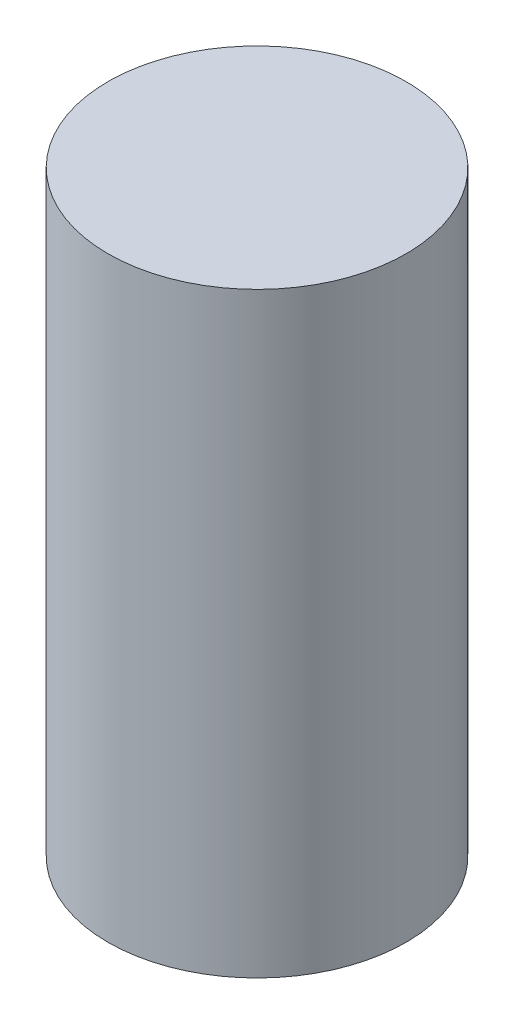
from build123d import *

# Parameters (mm, degrees)
SKETCH_2_R          = 10
EXTRUDE_1_DEPTH     = 40
SKETCH_3_R          = 2.5
CUT_EXTRUDE_1_DEPTH = 40


with BuildPart() as part:
    # 草图2 → 凸台-拉伸1 (new body)
    with BuildSketch(Plane(origin=(0, 0, 0), x_dir=(1, 0, 0), z_dir=(0, 1, 0))):
        with Locations(Location((0, 0, 0), (0, 0, 270))):
            Circle(SKETCH_2_R)
    extrude(amount=EXTRUDE_1_DEPTH)

    # 草图3 → 切除-拉伸1 (cut)
    with BuildSketch(Plane(origin=(0, 0, 0), x_dir=(0, 0, -1), z_dir=(1, 0, 0))):
        with Locations((0, 20)):
            Circle(SKETCH_3_R)
    extrude(amount=-CUT_EXTRUDE_1_DEPTH, mode=Mode.SUBTRACT)


solid = part.part
